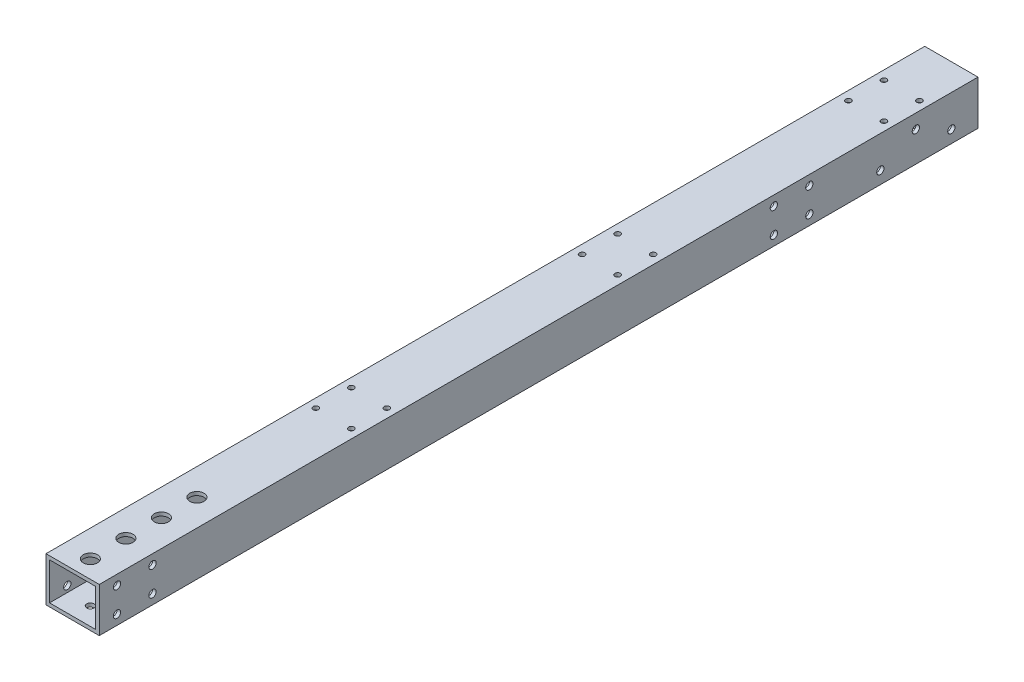
from build123d import *

# Parameters (mm, degrees)
SKETCH_1_W           = 30
SKETCH_1_H           = 25
SKETCH_1_W_2         = 26
SKETCH_1_H_2         = 21
EXTRUDE_1_DEPTH      = 510
CUT_EXTRUDE_4_REACH  = 512.833
SKETCH_7_R           = 2.05
CUT_EXTRUDE_7_DEPTH  = 512.03449003
SKETCH_9_R           = 2.05
CUT_EXTRUDE_9_DEPTH  = 10
SKETCH_10_R          = 4
CUT_EXTRUDE_10_DEPTH = 10
SKETCH_11_R          = 2.05
CUT_EXTRUDE_11_DEPTH = 52
SKETCH_12_W          = 15
SKETCH_12_H          = 25
CUT_EXTRUDE_12_DEPTH = 512.03449003
CUT_EXTRUDE_13_REACH = 512.833
SKETCH_5_R           = 1.55


with BuildPart() as part:
    # 草图1 → 凸台-拉伸1 (new body)
    with BuildSketch(Plane.XY):
        Rectangle(SKETCH_1_W, SKETCH_1_H)
        Rectangle(SKETCH_1_W_2, SKETCH_1_H_2, mode=Mode.SUBTRACT)
    extrude(amount=EXTRUDE_1_DEPTH)

    # 草图4 → 切除-拉伸4 (cut, up to next)
    with BuildSketch(Plane.XZ.offset(12.5), mode=Mode.PRIVATE) as cut_extrude_4_sk1:
        with BuildLine():
            Line((-7.5, 40), (-7.5, 60))
            ThreePointArc((-7.5, 60), (0, 67.5), (7.5, 60))
            Line((7.5, 60), (7.5, 40))
            ThreePointArc((7.5, 40), (0, 32.5), (-7.5, 40))
        make_face()
    cut_extrude_4_tool1 = extrude(cut_extrude_4_sk1.sketch, amount=-CUT_EXTRUDE_4_REACH, mode=Mode.PRIVATE) & part.part
    # 草图4 → 切除-拉伸4 (cut, up to next)
    with BuildSketch(Plane.XZ.offset(12.5), mode=Mode.PRIVATE) as cut_extrude_4_sk2:
        with BuildLine():
            Line((-7.5, 190), (-7.5, 210))
            ThreePointArc((-7.5, 210), (0, 217.5), (7.5, 210))
            Line((7.5, 210), (7.5, 190))
            ThreePointArc((7.5, 190), (0, 182.5), (-7.5, 190))
        make_face()
    cut_extrude_4_tool2 = extrude(cut_extrude_4_sk2.sketch, amount=-CUT_EXTRUDE_4_REACH, mode=Mode.PRIVATE) & part.part
    # 草图4 → 切除-拉伸4 (cut, up to next)
    with BuildSketch(Plane.XZ.offset(12.5), mode=Mode.PRIVATE) as cut_extrude_4_sk3:
        with BuildLine():
            Line((-7.5, 340), (-7.5, 360))
            ThreePointArc((-7.5, 360), (0, 367.5), (7.5, 360))
            Line((7.5, 360), (7.5, 340))
            ThreePointArc((7.5, 340), (0, 332.5), (-7.5, 340))
        make_face()
    cut_extrude_4_tool3 = extrude(cut_extrude_4_sk3.sketch, amount=-CUT_EXTRUDE_4_REACH, mode=Mode.PRIVATE) & part.part
    add(cut_extrude_4_tool1.solids().sort_by_distance((0, -12.5, 50))[0], mode=Mode.SUBTRACT)
    add(cut_extrude_4_tool2.solids().sort_by_distance((0, -12.5, 200))[0], mode=Mode.SUBTRACT)
    add(cut_extrude_4_tool3.solids().sort_by_distance((0, -12.5, 350))[0], mode=Mode.SUBTRACT)

    # 草图7 → 切除-拉伸7 (cut, through all)
    with BuildSketch(Plane(origin=(15, 0, 0), x_dir=(0, 0, -1), z_dir=(1, 0, 0))):
        with Locations((-30, -5.5)):
            Circle(SKETCH_7_R)
        with Locations((-50, 4.5)):
            Circle(SKETCH_7_R)
        with Locations((-70, -5.5)):
            Circle(SKETCH_7_R)
    extrude(amount=-CUT_EXTRUDE_7_DEPTH, mode=Mode.SUBTRACT)

    # 草图9 → 切除-拉伸9 (cut)
    with BuildSketch(Plane.XZ.offset(12.5)):
        with Locations(Location((0, 480, 0), (0, 0, 270))):
            Circle(SKETCH_9_R)
        with Locations(Location((0, 500, 0), (0, 0, 270))):
            Circle(SKETCH_9_R)
        with Locations(Location((0, 440, 0), (0, 0, 90))):
            Circle(SKETCH_9_R)
        with Locations(Location((0, 460, 0), (0, 0, 90))):
            Circle(SKETCH_9_R)
    extrude(amount=-CUT_EXTRUDE_9_DEPTH, mode=Mode.SUBTRACT)

    # 草图10 → 切除-拉伸10 (cut)
    with BuildSketch(Plane(origin=(0, 12.5, 0), x_dir=(1, 0, 0), z_dir=(0, 1, 0))):
        with Locations(Location((0, -500, 0), (0, 0, 270))):
            Circle(SKETCH_10_R)
        with Locations(Location((0, -480, 0), (0, 0, 270))):
            Circle(SKETCH_10_R)
        with Locations(Location((0, -460, 0), (0, 0, 90))):
            Circle(SKETCH_10_R)
        with Locations(Location((0, -440, 0), (0, 0, 90))):
            Circle(SKETCH_10_R)
    extrude(amount=-CUT_EXTRUDE_10_DEPTH, mode=Mode.SUBTRACT)

    # 草图11 → 切除-拉伸11 (cut)
    with BuildSketch(Plane.ZY.offset(15)):
        with Locations((480, 7)):
            Circle(SKETCH_11_R)
        with Locations((500, 7)):
            Circle(SKETCH_11_R)
        with Locations((480, -7)):
            Circle(SKETCH_11_R)
        with Locations((500, -7)):
            Circle(SKETCH_11_R)
        with Locations((110, 7)):
            Circle(SKETCH_11_R)
        with Locations((130, 7)):
            Circle(SKETCH_11_R)
        with Locations((110, -7)):
            Circle(SKETCH_11_R)
        with Locations((130, -7)):
            Circle(SKETCH_11_R)
    extrude(amount=-CUT_EXTRUDE_11_DEPTH, mode=Mode.SUBTRACT)

    # 草图12 → 切除-拉伸12 (cut, through all)
    with BuildSketch(Plane.ZY.offset(15)):
        with Locations((7.5, 0)):
            Rectangle(SKETCH_12_W, SKETCH_12_H)
    extrude(amount=-CUT_EXTRUDE_12_DEPTH, mode=Mode.SUBTRACT)

    # 草图5 → 切除-拉伸13 (cut, up to next)
    with BuildSketch(Plane(origin=(0, 12.5, 0), x_dir=(1, 0, 0), z_dir=(0, 1, 0)), mode=Mode.PRIVATE) as cut_extrude_13_sk1:
        with Locations(Location((-10, -43, 0), (0, 0, 270))):
            Circle(SKETCH_5_R)
    cut_extrude_13_tool1 = extrude(cut_extrude_13_sk1.sketch, amount=-CUT_EXTRUDE_13_REACH, mode=Mode.PRIVATE) & part.part
    # 草图5 → 切除-拉伸13 (cut, up to next)
    with BuildSketch(Plane(origin=(0, 12.5, 0), x_dir=(1, 0, 0), z_dir=(0, 1, 0)), mode=Mode.PRIVATE) as cut_extrude_13_sk2:
        with Locations(Location((10, -43, 0), (0, 0, 270))):
            Circle(SKETCH_5_R)
    cut_extrude_13_tool2 = extrude(cut_extrude_13_sk2.sketch, amount=-CUT_EXTRUDE_13_REACH, mode=Mode.PRIVATE) & part.part
    # 草图5 → 切除-拉伸13 (cut, up to next)
    with BuildSketch(Plane(origin=(0, 12.5, 0), x_dir=(1, 0, 0), z_dir=(0, 1, 0)), mode=Mode.PRIVATE) as cut_extrude_13_sk3:
        with Locations(Location((-10, -63, 0), (0, 0, 270))):
            Circle(SKETCH_5_R)
    cut_extrude_13_tool3 = extrude(cut_extrude_13_sk3.sketch, amount=-CUT_EXTRUDE_13_REACH, mode=Mode.PRIVATE) & part.part
    # 草图5 → 切除-拉伸13 (cut, up to next)
    with BuildSketch(Plane(origin=(0, 12.5, 0), x_dir=(1, 0, 0), z_dir=(0, 1, 0)), mode=Mode.PRIVATE) as cut_extrude_13_sk4:
        with Locations(Location((10, -63, 0), (0, 0, 270))):
            Circle(SKETCH_5_R)
    cut_extrude_13_tool4 = extrude(cut_extrude_13_sk4.sketch, amount=-CUT_EXTRUDE_13_REACH, mode=Mode.PRIVATE) & part.part
    # 草图5 → 切除-拉伸13 (cut, up to next)
    with BuildSketch(Plane(origin=(0, 12.5, 0), x_dir=(1, 0, 0), z_dir=(0, 1, 0)), mode=Mode.PRIVATE) as cut_extrude_13_sk5:
        with Locations(Location((-10, -193, 0), (0, 0, 270))):
            Circle(SKETCH_5_R)
    cut_extrude_13_tool5 = extrude(cut_extrude_13_sk5.sketch, amount=-CUT_EXTRUDE_13_REACH, mode=Mode.PRIVATE) & part.part
    # 草图5 → 切除-拉伸13 (cut, up to next)
    with BuildSketch(Plane(origin=(0, 12.5, 0), x_dir=(1, 0, 0), z_dir=(0, 1, 0)), mode=Mode.PRIVATE) as cut_extrude_13_sk6:
        with Locations(Location((-10, -213, 0), (0, 0, 270))):
            Circle(SKETCH_5_R)
    cut_extrude_13_tool6 = extrude(cut_extrude_13_sk6.sketch, amount=-CUT_EXTRUDE_13_REACH, mode=Mode.PRIVATE) & part.part
    # 草图5 → 切除-拉伸13 (cut, up to next)
    with BuildSketch(Plane(origin=(0, 12.5, 0), x_dir=(1, 0, 0), z_dir=(0, 1, 0)), mode=Mode.PRIVATE) as cut_extrude_13_sk7:
        with Locations(Location((10, -193, 0), (0, 0, 270))):
            Circle(SKETCH_5_R)
    cut_extrude_13_tool7 = extrude(cut_extrude_13_sk7.sketch, amount=-CUT_EXTRUDE_13_REACH, mode=Mode.PRIVATE) & part.part
    # 草图5 → 切除-拉伸13 (cut, up to next)
    with BuildSketch(Plane(origin=(0, 12.5, 0), x_dir=(1, 0, 0), z_dir=(0, 1, 0)), mode=Mode.PRIVATE) as cut_extrude_13_sk8:
        with Locations(Location((10, -213, 0), (0, 0, 270))):
            Circle(SKETCH_5_R)
    cut_extrude_13_tool8 = extrude(cut_extrude_13_sk8.sketch, amount=-CUT_EXTRUDE_13_REACH, mode=Mode.PRIVATE) & part.part
    # 草图5 → 切除-拉伸13 (cut, up to next)
    with BuildSketch(Plane(origin=(0, 12.5, 0), x_dir=(1, 0, 0), z_dir=(0, 1, 0)), mode=Mode.PRIVATE) as cut_extrude_13_sk9:
        with Locations(Location((-10, -343, 0), (0, 0, 270))):
            Circle(SKETCH_5_R)
    cut_extrude_13_tool9 = extrude(cut_extrude_13_sk9.sketch, amount=-CUT_EXTRUDE_13_REACH, mode=Mode.PRIVATE) & part.part
    # 草图5 → 切除-拉伸13 (cut, up to next)
    with BuildSketch(Plane(origin=(0, 12.5, 0), x_dir=(1, 0, 0), z_dir=(0, 1, 0)), mode=Mode.PRIVATE) as cut_extrude_13_sk10:
        with Locations(Location((-10, -363, 0), (0, 0, 270))):
            Circle(SKETCH_5_R)
    cut_extrude_13_tool10 = extrude(cut_extrude_13_sk10.sketch, amount=-CUT_EXTRUDE_13_REACH, mode=Mode.PRIVATE) & part.part
    # 草图5 → 切除-拉伸13 (cut, up to next)
    with BuildSketch(Plane(origin=(0, 12.5, 0), x_dir=(1, 0, 0), z_dir=(0, 1, 0)), mode=Mode.PRIVATE) as cut_extrude_13_sk11:
        with Locations(Location((10, -343, 0), (0, 0, 270))):
            Circle(SKETCH_5_R)
    cut_extrude_13_tool11 = extrude(cut_extrude_13_sk11.sketch, amount=-CUT_EXTRUDE_13_REACH, mode=Mode.PRIVATE) & part.part
    # 草图5 → 切除-拉伸13 (cut, up to next)
    with BuildSketch(Plane(origin=(0, 12.5, 0), x_dir=(1, 0, 0), z_dir=(0, 1, 0)), mode=Mode.PRIVATE) as cut_extrude_13_sk12:
        with Locations(Location((10, -363, 0), (0, 0, 270))):
            Circle(SKETCH_5_R)
    cut_extrude_13_tool12 = extrude(cut_extrude_13_sk12.sketch, amount=-CUT_EXTRUDE_13_REACH, mode=Mode.PRIVATE) & part.part
    add(cut_extrude_13_tool1.solids().sort_by_distance((-10, 12.5, 43))[0], mode=Mode.SUBTRACT)
    add(cut_extrude_13_tool2.solids().sort_by_distance((10, 12.5, 43))[0], mode=Mode.SUBTRACT)
    add(cut_extrude_13_tool3.solids().sort_by_distance((-10, 12.5, 63))[0], mode=Mode.SUBTRACT)
    add(cut_extrude_13_tool4.solids().sort_by_distance((10, 12.5, 63))[0], mode=Mode.SUBTRACT)
    add(cut_extrude_13_tool5.solids().sort_by_distance((-10, 12.5, 193))[0], mode=Mode.SUBTRACT)
    add(cut_extrude_13_tool6.solids().sort_by_distance((-10, 12.5, 213))[0], mode=Mode.SUBTRACT)
    add(cut_extrude_13_tool7.solids().sort_by_distance((10, 12.5, 193))[0], mode=Mode.SUBTRACT)
    add(cut_extrude_13_tool8.solids().sort_by_distance((10, 12.5, 213))[0], mode=Mode.SUBTRACT)
    add(cut_extrude_13_tool9.solids().sort_by_distance((-10, 12.5, 343))[0], mode=Mode.SUBTRACT)
    add(cut_extrude_13_tool10.solids().sort_by_distance((-10, 12.5, 363))[0], mode=Mode.SUBTRACT)
    add(cut_extrude_13_tool11.solids().sort_by_distance((10, 12.5, 343))[0], mode=Mode.SUBTRACT)
    add(cut_extrude_13_tool12.solids().sort_by_distance((10, 12.5, 363))[0], mode=Mode.SUBTRACT)


solid = part.part
